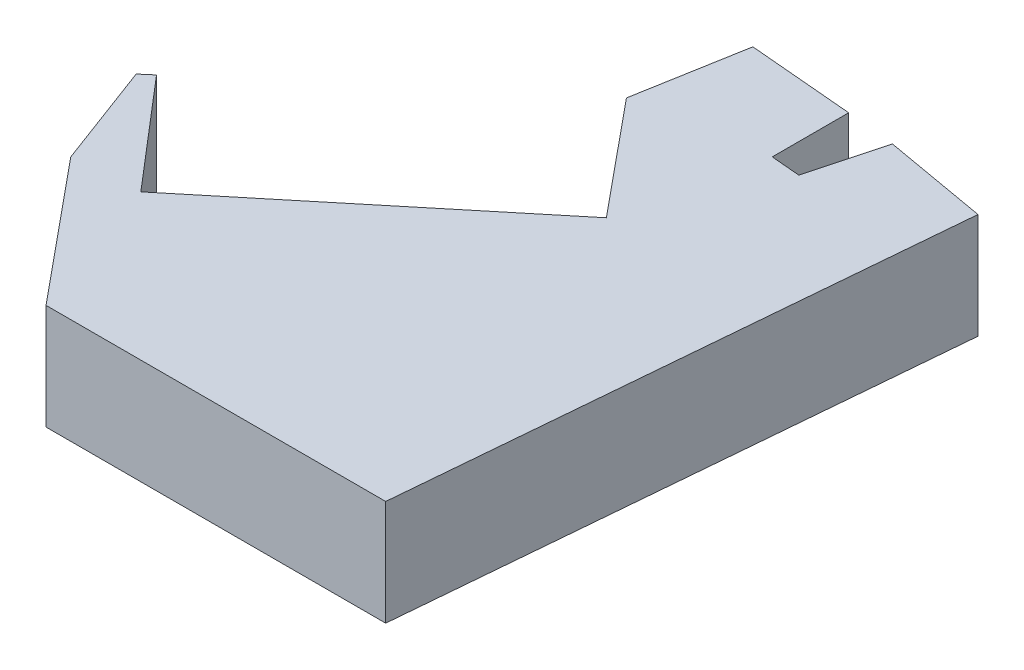
from build123d import *

# Parameters (mm, degrees)
EXTRUDE_1_DEPTH = 18


with BuildPart() as part:
    # 草图1 → 凸台-拉伸1 (new body)
    with BuildSketch(Plane(origin=(0, 0, 0), x_dir=(1, 0, 0), z_dir=(0, 1, 0))):
        Polygon((0, 0), (58, 0), (66.136445708, 93), (48.409906154, 96.125667198), (45.03240616, 83.52066562), (40.05143267, 83.956444333), (40.05143267, 97.006102221), (22.119928104, 98.574905591), (18.883221447, 80.218629971), (34.893679486, 60.79168826), (-8.685088493, 24.87682083), (-24.635093999, 43.503569762), (-26.50592326, 41.901586661), (-19.833529743, 24.065821558), align=None)
    extrude(amount=EXTRUDE_1_DEPTH)


solid = part.part
